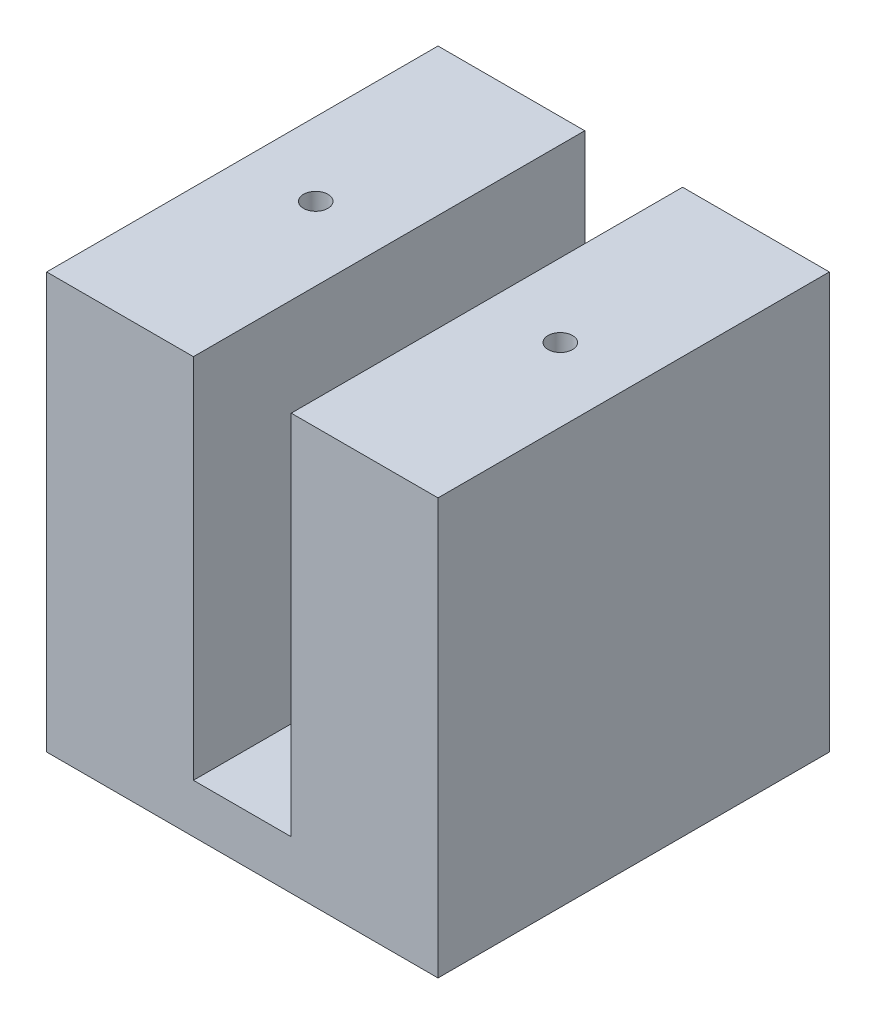
from build123d import *

# Parameters (mm, degrees)
SKETCH1_W           = 50.8
SKETCH1_H           = 50.8
BOSS_EXTRUDE1_DEPTH = 6.35
SKETCH2_W           = 19.05
SKETCH2_H           = 50.8
BOSS_EXTRUDE2_DEPTH = 47.625
SKETCH3_R           = 1.5875
CUT_EXTRUDE1_DEPTH  = 60.652834174
SKETCH4_R           = 1.5875
CUT_EXTRUDE2_DEPTH  = 65.835334695


with BuildPart() as part:
    # Sketch1 → Boss-Extrude1 (new body)
    with BuildSketch(Plane(origin=(0, 0, 0), x_dir=(1, 0, 0), z_dir=(0, 1, 0))):
        Rectangle(SKETCH1_W, SKETCH1_H)
    extrude(amount=BOSS_EXTRUDE1_DEPTH)

    # Sketch2 → Boss-Extrude2 (add)
    with BuildSketch(Plane(origin=(0, 6.35, 0), x_dir=(1, 0, 0), z_dir=(0, 1, 0))):
        with Locations((-15.875, 0)):
            Rectangle(SKETCH2_W, SKETCH2_H)
        with Locations((15.875, 0)):
            Rectangle(SKETCH2_W, SKETCH2_H)
    extrude(amount=BOSS_EXTRUDE2_DEPTH)

    # Sketch3 → Cut-Extrude1 (cut, through all)
    with BuildSketch(Plane(origin=(0, 6.35, 0), x_dir=(1, 0, 0), z_dir=(0, 1, 0))):
        with Locations(Location((0, 6.35, 0), (0, 0, 270))):
            Circle(SKETCH3_R)
        with Locations(Location((0, -6.35, 0), (0, 0, 270))):
            Circle(SKETCH3_R)
    extrude(amount=-CUT_EXTRUDE1_DEPTH, mode=Mode.SUBTRACT)

    # Sketch4 → Cut-Extrude2 (cut, through all)
    with BuildSketch(Plane(origin=(0, 53.975, 0), x_dir=(1, 0, 0), z_dir=(0, 1, 0))):
        with Locations(Location((-15.875, 0, 0), (0, 0, 270))):
            Circle(SKETCH4_R)
        with Locations(Location((15.875, 0, 0), (0, 0, 270))):
            Circle(SKETCH4_R)
    extrude(amount=-CUT_EXTRUDE2_DEPTH, mode=Mode.SUBTRACT)


solid = part.part
